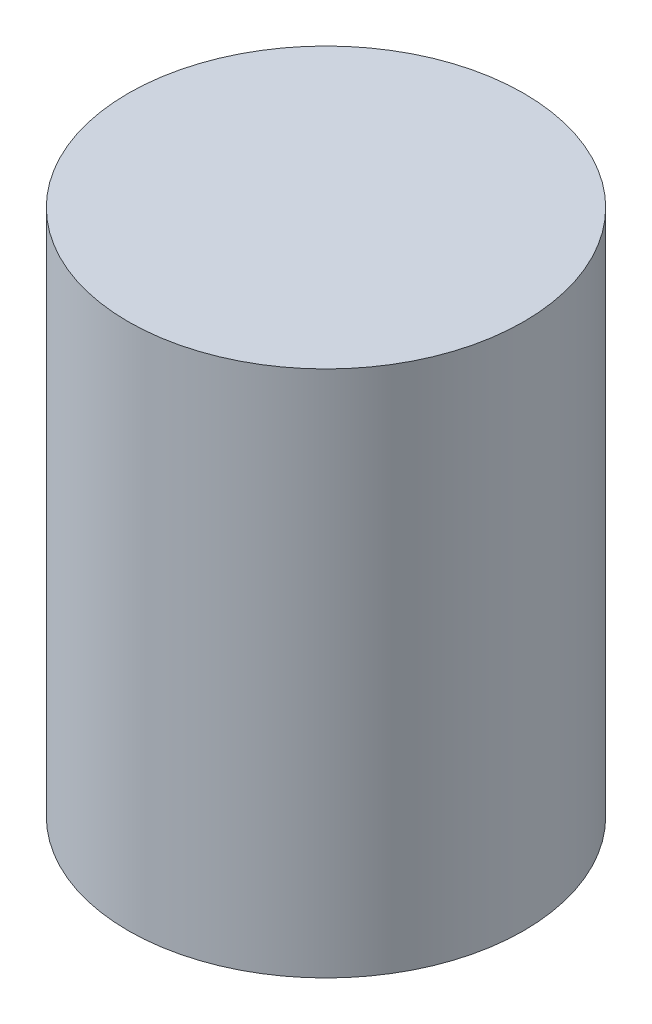
from build123d import *

# Parameters (mm, degrees)
KOLA1L_BOYUN_D30_START = 225
SKETCH1_R              = 15
KOLA1L_BOYUN_D30_DEPTH = 40


with BuildPart() as part:
    # Sketch1 → KOLA1L_boyun_D30 (new body)
    with BuildSketch(Plane(origin=(0, 0, 0), x_dir=(1, 0, 0), z_dir=(0, 1, 0)).offset(KOLA1L_BOYUN_D30_START)):
        with Locations(Location((0, 0, 0), (0, 0, 270))):
            Circle(SKETCH1_R)
    extrude(amount=KOLA1L_BOYUN_D30_DEPTH)


solid = part.part
